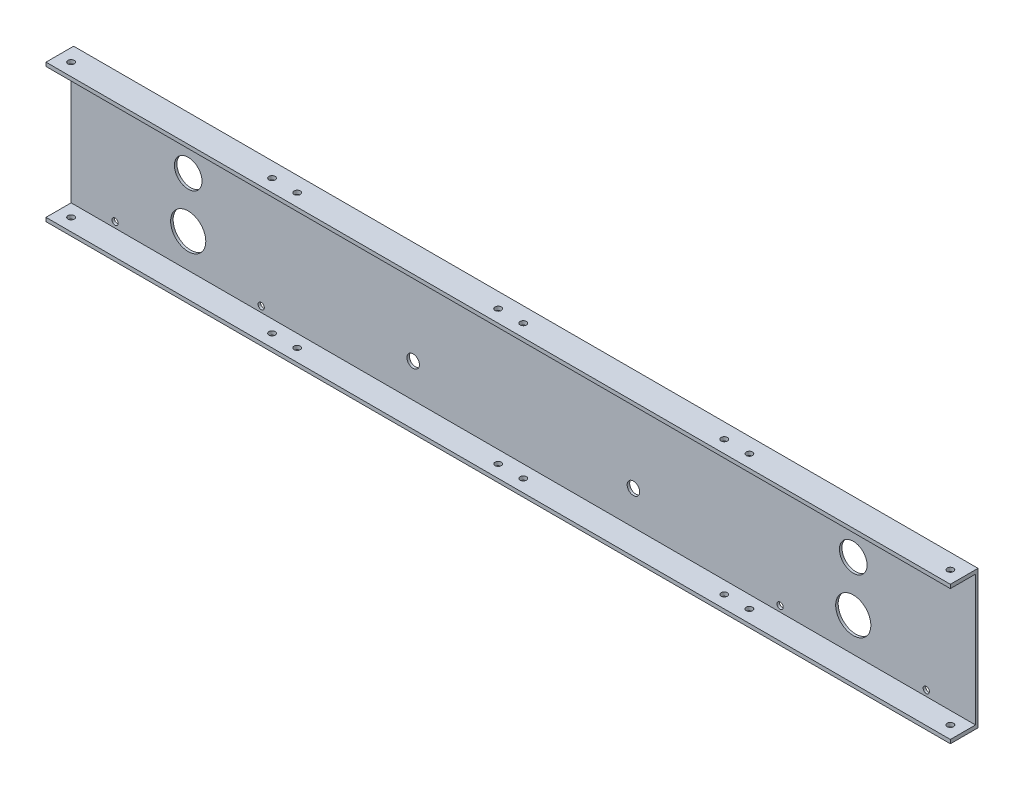
from build123d import *

# Parameters (mm, degrees)
SKETCH_1_W          = 720
SKETCH_1_H          = 110
SKETCH_1_R          = 11
SKETCH_1_R_2        = 14
SKETCH_1_R_3        = 2.5
SKETCH_1_R_4        = 5
EXTRUDE_1_DEPTH     = 2
SKETCH_2_W          = 720
SKETCH_2_H          = 3
EXTRUDE_2_DEPTH     = 20
SKETCH_3_R          = 2.5
CUT_EXTRUDE_3_DEPTH = 114


with BuildPart() as part:
    # 草图1 → 凸台-拉伸1 (new body)
    with BuildSketch(Plane.XY):
        with Locations((266.780748393, 19.519407272)):
            Rectangle(SKETCH_1_W, SKETCH_1_H)
        with Locations((529.466526581, 34.519407272)):
            Circle(SKETCH_1_R, mode=Mode.SUBTRACT)
        with Locations((0, 34.519407272)):
            Circle(SKETCH_1_R, mode=Mode.SUBTRACT)
        with Locations((0, -5.480592728)):
            Circle(SKETCH_1_R_2, mode=Mode.SUBTRACT)
        with Locations((58.117699254, -27.930592728)):
            Circle(SKETCH_1_R_3, mode=Mode.SUBTRACT)
        with Locations((58.25, 59.969407272)):
            Circle(SKETCH_1_R_3, mode=Mode.SUBTRACT)
        with Locations((-58.25, 59.969407272)):
            Circle(SKETCH_1_R_3, mode=Mode.SUBTRACT)
        with Locations((179.094970205, -5.480592728)):
            Circle(SKETCH_1_R_4, mode=Mode.SUBTRACT)
        with Locations((354.466526581, -5.480592728)):
            Circle(SKETCH_1_R_4, mode=Mode.SUBTRACT)
        with Locations((-58.25, -27.930592728)):
            Circle(SKETCH_1_R_3, mode=Mode.SUBTRACT)
        with Locations((529.466526581, -5.480592728)):
            Circle(SKETCH_1_R_2, mode=Mode.SUBTRACT)
        with Locations((587.584225835, -27.930592728)):
            Circle(SKETCH_1_R_3, mode=Mode.SUBTRACT)
        with Locations((587.716526581, 59.969407272)):
            Circle(SKETCH_1_R_3, mode=Mode.SUBTRACT)
        with Locations((471.216526581, 59.969407272)):
            Circle(SKETCH_1_R_3, mode=Mode.SUBTRACT)
        with Locations((471.216526582, -27.930592728)):
            Circle(SKETCH_1_R_3, mode=Mode.SUBTRACT)
    extrude(amount=EXTRUDE_1_DEPTH)

    # 草图2 → 凸台-拉伸2 (add)
    with BuildSketch(Plane.XY.offset(2)):
        with Locations((266.780748393, 73.019407272)):
            Rectangle(SKETCH_2_W, SKETCH_2_H)
        with Locations((266.780748393, -33.980592728)):
            Rectangle(SKETCH_2_W, SKETCH_2_H)
    extrude(amount=EXTRUDE_2_DEPTH)

    # 草图3 → 切除-拉伸3 (cut)
    with BuildSketch(Plane(origin=(0, 74.519407272, 0), x_dir=(1, 0, 0), z_dir=(0, 1, 0))):
        with Locations(Location((456.780748393, -12, 0), (0, 0, 270))):
            Circle(SKETCH_3_R)
        with Locations(Location((616.780748393, -12, 0), (0, 0, 270))):
            Circle(SKETCH_3_R)
        with Locations(Location((436.780748393, -12, 0), (0, 0, 270))):
            Circle(SKETCH_3_R)
        with Locations(Location((276.780748393, -12, 0), (0, 0, 270))):
            Circle(SKETCH_3_R)
        with Locations(Location((256.780748393, -12, 0), (0, 0, 270))):
            Circle(SKETCH_3_R)
        with Locations(Location((96.780748393, -12, 0), (0, 0, 270))):
            Circle(SKETCH_3_R)
        with Locations(Location((76.780748393, -12, 0), (0, 0, 270))):
            Circle(SKETCH_3_R)
        with Locations(Location((-83.219251607, -12, 0), (0, 0, 270))):
            Circle(SKETCH_3_R)
    extrude(amount=-CUT_EXTRUDE_3_DEPTH, mode=Mode.SUBTRACT)


solid = part.part
